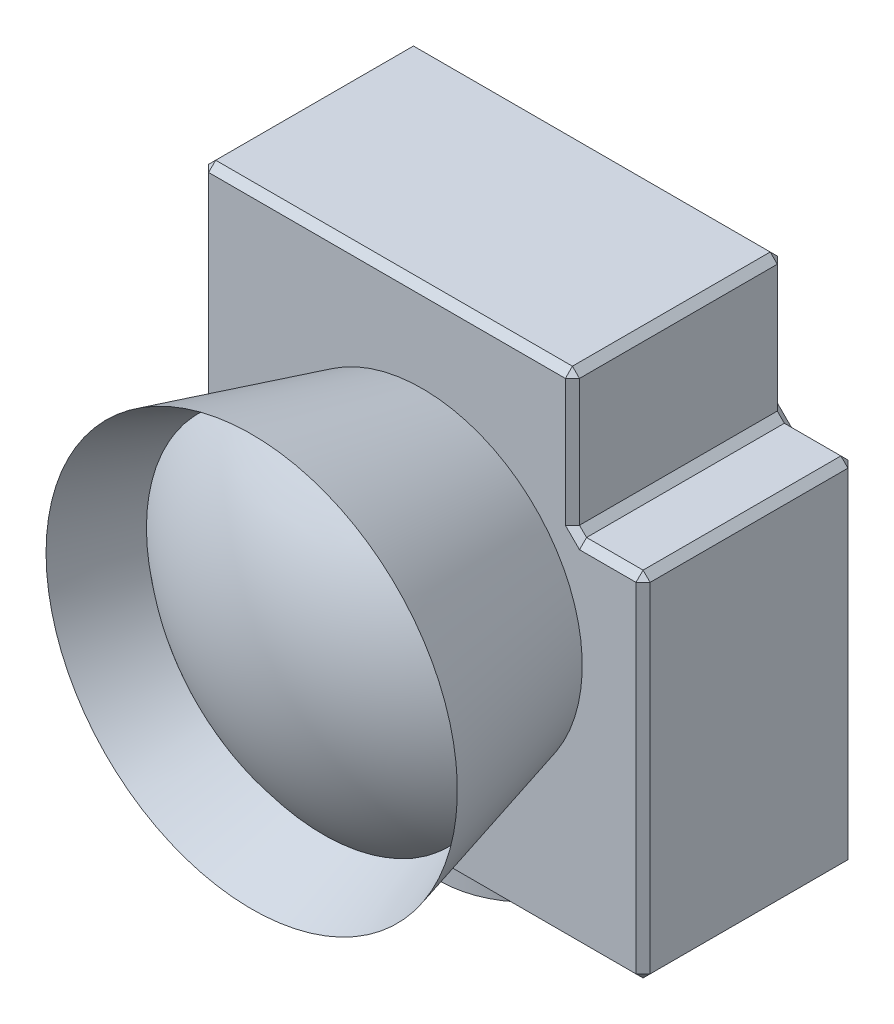
from build123d import *

# Parameters (mm, degrees)
BOSS_EXTRUDE1_DEPTH = 15
SKETCH2_R           = 12.5
BOSS_EXTRUDE2_DEPTH = 4
CHAMFER1_SIZE       = 1


with BuildPart() as part:
    # Sketch1 → Boss-Extrude1 (new, symmetric)
    with BuildSketch(Plane.XY):
        Polygon((21.25, 35), (-31.25, 35), (-31.25, -35), (31.25, -35), (31.25, 15), (21.25, 15), align=None)
    extrude(amount=BOSS_EXTRUDE1_DEPTH, both=True)

    # Sketch2 → Boss-Extrude2 (add, symmetric)
    with BuildSketch(Plane.XZ.offset(35)):
        with Locations(Location((0, 0, 0), (0, 0, 90))):
            Circle(SKETCH2_R)
    extrude(amount=BOSS_EXTRUDE2_DEPTH, both=True)

    # Chamfer1
    chamfer1_edges = [part.edges().sort_by_distance(p)[0] for p in [
        (-31.25, 35, 0),
        (21.25, 35, 0),
        (21.25, 15, 0),
        (31.25, 15, 0),
        (31.25, -35, 0),
        (-31.25, -35, 0),
        (31.25, -10, 15),
        (26.25, 15, 15),
        (21.25, 25, 15),
        (-5, 35, 15),
        (-31.25, 0, 15),
        (-5, 35, -15),
        (21.25, 25, -15),
        (26.25, 15, -15),
        (31.25, -10, -15),
        (0, -35, -15),
        (-31.25, 0, -15),
        (0, -35, 15),
    ]]
    chamfer(chamfer1_edges, length=CHAMFER1_SIZE)

    # Sketch4 → Revolve1 (revolve)
    with BuildSketch(Plane(origin=(0, 0, 0), x_dir=(1, 0, 0), z_dir=(0, 1, 0))):
        Polygon((-22.640271435, -15), (-29.110747562, -39.148145657), (-19.473991816, -15), align=None)
    revolve(axis=Axis((0, 0, 0), (0, 0, 1)))


with BuildPart() as body_2:
    # Sketch5 → Revolve2 (revolve)
    with BuildSketch(Plane(origin=(0, 0, 0), x_dir=(1, 0, 0), z_dir=(0, 1, 0))):
        with BuildLine():
            Line((0, -33.750156277), (0, -38.321403444))
            ThreePointArc((0, -38.321403444), (-13.369092543, -35.913748433), (-25.058279875, -28.993319431))
            add(Edge.make_bspline(
                [(-25.058279875, -28.993319431), (-12.529139937, -33.750156277), (0, -33.750156277)],
                knots=[0, 0, 0, 0.5, 0.5, 0.5], degree=2))
        make_face()
    revolve(axis=Axis((0, 0, 0), (0, 0, 1)))


solid = Compound([part.part, body_2.part])
